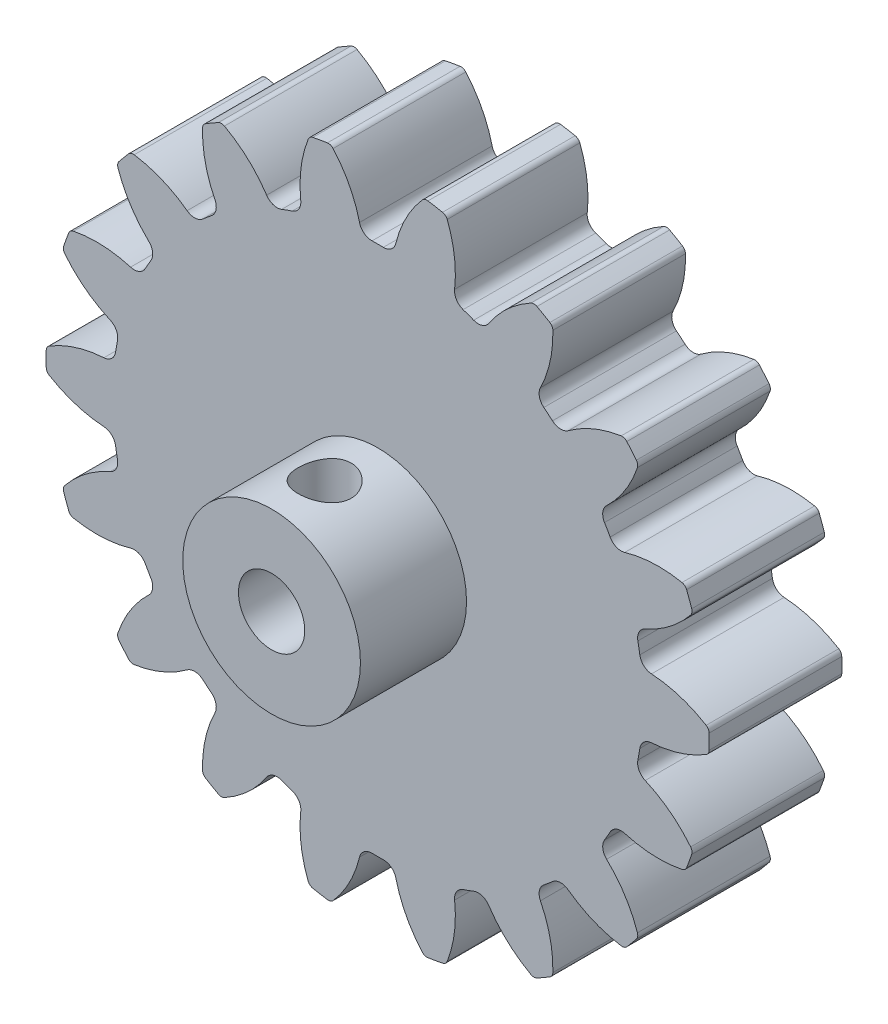
from build123d import *
from build123d.topology import SkipClean

# Parameters (mm, degrees)
SKETCH4_W                = 10
SKETCH4_H                = 25
CUT_EXTRUDE2_DEPTH       = 37.742346142
FILLET3_R                = 0.95
FILLET4_R                = 0.475
CIRPATTERN1_COUNT        = 18
FILLET3_OF_CIRPATTERN1_R = 0.95
FILLET4_OF_CIRPATTERN1_R = 0.475
ESQUISSE1_R              = 6.7
ESQUISSE1_R_2            = 2.5
BOSS_EXTRU_1_DEPTH       = 8
ESQUISSE4_W              = 2
ESQUISSE4_H              = 24.716679221
ESQUISSE5_R              = 2.5
ENL_V_MAT_EXTRU_1_DEPTH  = 37.550160657


with BuildPart() as part:
    # Sketch4 → Revolve1 (revolve)
    with BuildSketch(Plane(origin=(0, 0, 0), x_dir=(0, 0, -1), z_dir=(1, 0, 0))):
        with Locations((-5, 12.5)):
            Rectangle(SKETCH4_W, SKETCH4_H)
    revolve(axis=Axis((0, 0, 0), (0, 0, 1)))

    # Sketch7 → Cut-Extrude2 (cut, through all)
    with BuildSketch(Plane.XY.offset(10)):
        with BuildLine():
            ThreePointArc((-3.5355314, 24.748737699), (0, 25), (3.5355314, 24.748737699))
            ThreePointArc((3.5355314, 24.748737699), (2.016235427, 22.530646445), (1.219895684, 19.962761696))
            ThreePointArc((1.219895684, 19.962761696), (0, 20), (-1.219895684, 19.962761696))
            ThreePointArc((-1.219895684, 19.962761696), (-2.016235427, 22.530646445), (-3.5355314, 24.748737699))
        make_face()
    cut_extrude2 = extrude(amount=-CUT_EXTRUDE2_DEPTH, mode=Mode.SUBTRACT)

    # Fillet3
    fillet3_edges = [part.edges().sort_by_distance(p)[0] for p in [
        (-1.219895684, 19.962761696, 5),
        (1.219895684, 19.962761696, 5),
    ]]
    fillet(fillet3_edges, radius=FILLET3_R)

    # Fillet4
    fillet4_edges = [part.edges().sort_by_distance(p)[0] for p in [
        (-3.5355314, 24.748737699, 5),
        (3.5355314, 24.748737699, 5),
    ]]
    fillet(fillet4_edges, radius=FILLET4_R)

    # CirPattern1: Cut-Extrude2 ×18 about axis
    cirpattern1_axis = Axis((0, 0, 0), (0, 0, 1))
    for i in range(1, CIRPATTERN1_COUNT):
        add(cut_extrude2.rotate(cirpattern1_axis, i * 360 / CIRPATTERN1_COUNT), mode=Mode.SUBTRACT)

    # Fillet3 of CirPattern1
    fillet3_of_cirpattern1_edges = [part.edges().sort_by_distance(p)[0] for p in [
        (-7.973993588, 18.341630959, 5),
        (-5.681339644, 19.176088753, 5),
        (-13.766310183, 14.508228836, 5),
        (-11.897321564, 16.076496497, 5),
        (-17.8982066, 8.924920196, 5),
        (-16.678310916, 11.0378415, 5),
        (-19.871315152, 2.265134463, 5),
        (-19.447649827, 4.667859917, 5),
        (-19.447649827, -4.667859917, 5),
        (-19.871315152, -2.265134463, 5),
        (-16.678310916, -11.0378415, 5),
        (-17.8982066, -8.924920196, 5),
        (-11.897321564, -16.076496497, 5),
        (-13.766310183, -14.508228836, 5),
        (-5.681339644, -19.176088753, 5),
        (-7.973993588, -18.341630959, 5),
        (1.219895684, -19.962761696, 5),
        (-1.219895684, -19.962761696, 5),
        (7.973993588, -18.341630959, 5),
        (5.681339644, -19.176088753, 5),
        (13.766310183, -14.508228836, 5),
        (11.897321564, -16.076496497, 5),
        (17.8982066, -8.924920196, 5),
        (16.678310916, -11.0378415, 5),
        (19.871315152, -2.265134463, 5),
        (19.447649827, -4.667859917, 5),
        (19.447649827, 4.667859917, 5),
        (19.871315152, 2.265134463, 5),
        (16.678310916, 11.0378415, 5),
        (17.8982066, 8.924920196, 5),
        (11.897321564, 16.076496497, 5),
        (13.766310183, 14.508228836, 5),
        (5.681339644, 19.176088753, 5),
        (7.973993588, 18.341630959, 5),
    ]]
    fillet(fillet3_of_cirpattern1_edges, radius=FILLET3_OF_CIRPATTERN1_R)

    # Fillet4 of CirPattern1
    fillet4_of_cirpattern1_edges = [part.edges().sort_by_distance(p)[0] for p in [
        (-11.786879583, 22.046983234, 5),
        (-5.142254048, 24.465429146, 5),
        (-18.616556131, 16.686037211, 5),
        (-13.199807766, 21.231228767, 5),
        (-23.20080126, 9.312508841, 5),
        (-19.665269859, 15.436228858, 5),
        (-24.986687348, 0.815754467, 5),
        (-23.758810179, 7.779391935, 5),
        (-23.758810179, -7.779391935, 5),
        (-24.986687348, -0.815754467, 5),
        (-19.665269859, -15.436228858, 5),
        (-23.20080126, -9.312508841, 5),
        (-13.199807766, -21.231228767, 5),
        (-18.616556131, -16.686037211, 5),
        (-5.142254048, -24.465429146, 5),
        (-11.786879583, -22.046983234, 5),
        (3.5355314, -24.748737699, 5),
        (-3.5355314, -24.748737699, 5),
        (11.786879583, -22.046983234, 5),
        (5.142254048, -24.465429146, 5),
        (18.616556131, -16.686037211, 5),
        (13.199807766, -21.231228767, 5),
        (23.20080126, -9.312508841, 5),
        (19.665269859, -15.436228858, 5),
        (24.986687348, -0.815754467, 5),
        (23.758810179, -7.779391935, 5),
        (23.758810179, 7.779391935, 5),
        (24.986687348, 0.815754467, 5),
        (19.665269859, 15.436228858, 5),
        (23.20080126, 9.312508841, 5),
        (13.199807766, 21.231228767, 5),
        (18.616556131, 16.686037211, 5),
        (5.142254048, 24.465429146, 5),
        (11.786879583, 22.046983234, 5),
    ]]
    fillet(fillet4_of_cirpattern1_edges, radius=FILLET4_OF_CIRPATTERN1_R)

    # Esquisse1 → Boss.-Extru.1 (add)
    with BuildSketch(Plane.XY.offset(10)):
        Circle(ESQUISSE1_R)
        with Locations(Location((0, 0, 0), (0, 0, 270))):
            Circle(ESQUISSE1_R_2, mode=Mode.SUBTRACT)
    extrude(amount=BOSS_EXTRU_1_DEPTH)

    # Esquisse4 → Diamètre du perçage Ø4.0 (4)1 (revolve, cut)
    with BuildSketch(Plane(origin=(0, 0, 14), x_dir=(0, 0, -1), z_dir=(1, 0, 0))):
        with Locations((1, 12.358339611)):
            Rectangle(ESQUISSE4_W, ESQUISSE4_H)
    revolve(axis=Axis((0, -6.35, 14), (0, 1, 0)), mode=Mode.SUBTRACT)

    # Esquisse5 → Enlèv. mat.-Extru.1 (cut, through all)
    with SkipClean():  # the faces are left unmerged after this step: merging them gives an invalid solid
        with BuildSketch(Plane.XY.offset(10)):
            Circle(ESQUISSE5_R)
        extrude(amount=-ENL_V_MAT_EXTRU_1_DEPTH, mode=Mode.SUBTRACT)


solid = part.part
